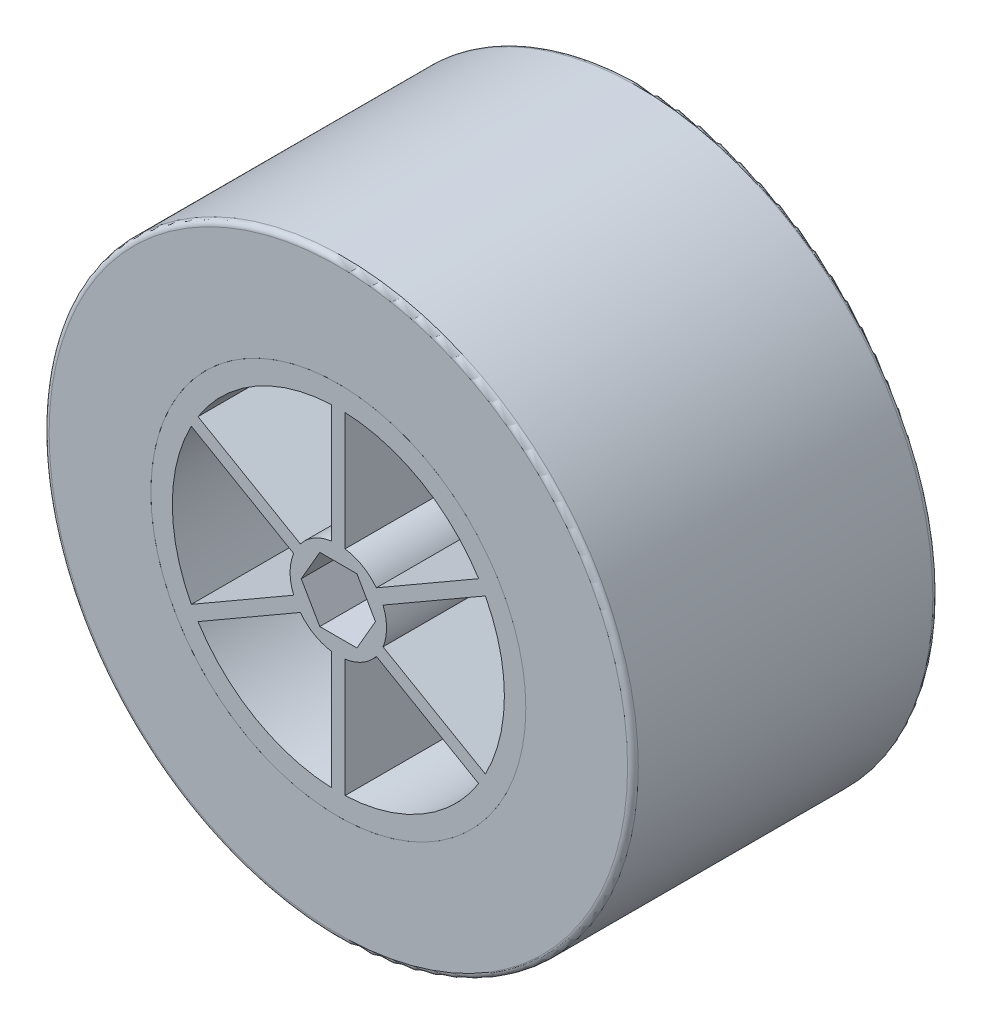
from build123d import *

# Parameters (mm, degrees)
EXTRUDE_1_DEPTH      = 28.5
EXTRUDE_1_DEPTH_BACK = 28.5
SKETCH_1_R           = 55
SKETCH_1_R_2         = 35
FILLET_1_R           = 1
SKETCH_2_R           = 35
SKETCH_2_R_2         = 31
EXTRUDE_2_DEPTH      = 57
EXTRUDE_3_DEPTH      = 57
EXTRUDE_4_DEPTH      = 2
EXTRUDE_4_DEPTH_BACK = 10
EXTRUDE_5_DEPTH      = 10
FILLET_2_R           = 2
FILLET_3_R           = 2


with BuildPart() as part:
    # ｽｹｯﾁ1 → ﾎﾞｽ - 押し出し1 (new, two sides: drawn at the far end of the back side and taken through both)
    with BuildSketch(Plane.XY.offset(-EXTRUDE_1_DEPTH_BACK)):
        Circle(SKETCH_1_R)
        Circle(SKETCH_1_R_2, mode=Mode.SUBTRACT)
    extrude(amount=EXTRUDE_1_DEPTH + EXTRUDE_1_DEPTH_BACK)

    # ﾌｨﾚｯﾄ1
    fillet_1_edges = [part.edges().sort_by_distance(p)[0] for p in [
        (-55, 0, -28.5),
        (-55, 0, 28.5),
    ]]
    fillet(fillet_1_edges, radius=FILLET_1_R)


with BuildPart() as body_2:
    # ｽｹｯﾁ2 → ﾎﾞｽ - 押し出し2 (new body)
    with BuildSketch(Plane(origin=(0, 0, -28.5), x_dir=(-1, 0, 0), z_dir=(0, 0, -1))):
        Circle(SKETCH_2_R)
        Circle(SKETCH_2_R_2, mode=Mode.SUBTRACT)
    extrude(amount=-EXTRUDE_2_DEPTH)

    # ｽｹｯﾁ3 → ﾎﾞｽ - 押し出し3 (add)
    with BuildSketch(Plane(origin=(0, 0, -28.5), x_dir=(-1, 0, 0), z_dir=(0, 0, -1))):
        with BuildLine():
            ThreePointArc((1.25, 30.974788135), (0, 31), (-1.25, 30.974788135))
            Line((-1.25, 30.974788135), (-1.25, 8.912771735))
            ThreePointArc((-1.25, 8.912771735), (-4.5, 7.794228634), (-7.093686741, 5.538917622))
            Line((-7.093686741, 5.538917622), (-26.199953402, 16.569925822))
            ThreePointArc((-26.199953402, 16.569925822), (-26.846787517, 15.5), (-27.449953402, 14.404862313))
            Line((-27.449953402, 14.404862313), (-8.343686741, 3.373854113))
            ThreePointArc((-8.343686741, 3.373854113), (-9, 0), (-8.343686741, -3.373854113))
            Line((-8.343686741, -3.373854113), (-27.449953402, -14.404862313))
            ThreePointArc((-27.449953402, -14.404862313), (-26.846787517, -15.5), (-26.199953402, -16.569925822))
            Line((-26.199953402, -16.569925822), (-7.093686741, -5.538917622))
            ThreePointArc((-7.093686741, -5.538917622), (-4.5, -7.794228634), (-1.25, -8.912771735))
            Line((-1.25, -8.912771735), (-1.25, -30.974788135))
            ThreePointArc((-1.25, -30.974788135), (0, -31), (1.25, -30.974788135))
            Line((1.25, -30.974788135), (1.25, -8.912771735))
            ThreePointArc((1.25, -8.912771735), (4.5, -7.794228634), (7.093686741, -5.538917622))
            Line((7.093686741, -5.538917622), (26.199953402, -16.569925822))
            ThreePointArc((26.199953402, -16.569925822), (26.846787517, -15.5), (27.449953402, -14.404862313))
            Line((27.449953402, -14.404862313), (8.343686741, -3.373854113))
            ThreePointArc((8.343686741, -3.373854113), (9, 0), (8.343686741, 3.373854113))
            Line((8.343686741, 3.373854113), (27.449953402, 14.404862313))
            ThreePointArc((27.449953402, 14.404862313), (26.846787517, 15.5), (26.199953402, 16.569925822))
            Line((26.199953402, 16.569925822), (7.093686741, 5.538917622))
            ThreePointArc((7.093686741, 5.538917622), (4.5, 7.794228634), (1.25, 8.912771735))
            Line((1.25, 8.912771735), (1.25, 30.974788135))
        make_face()
        Polygon((-3.464101615, 6), (3.464101615, 6), (6.92820323, 0), (3.464101615, -6), (-3.464101615, -6), (-6.92820323, 0), align=None, mode=Mode.SUBTRACT)
    extrude(amount=-EXTRUDE_3_DEPTH)


with BuildPart() as body_3:
    # ｽｹｯﾁ4 → ﾎﾞｽ - 押し出し4 (new, two sides: drawn at the far end of the back side and taken through both)
    with BuildSketch(Plane(origin=(0, 0, -28.5), x_dir=(-1, 0, 0), z_dir=(0, 0, -1)).offset(-EXTRUDE_4_DEPTH_BACK)):
        Polygon((-3.464101615, 6), (-6.92820323, 0), (-3.464101615, -6), (3.464101615, -6), (6.92820323, 0), (3.464101615, 6), align=None)
        with BuildLine():
            Line((-1.322875656, 1.5), (1.322875656, 1.5))
            ThreePointArc((1.322875656, 1.5), (0, -2), (-1.322875656, 1.5))
        make_face(mode=Mode.SUBTRACT)
    extrude(amount=EXTRUDE_4_DEPTH + EXTRUDE_4_DEPTH_BACK)

    # ｽｹｯﾁ7 → ﾎﾞｽ - 押し出し5 (add)
    with BuildSketch(Plane(origin=(0, 0, -30.5), x_dir=(-1, 0, 0), z_dir=(0, 0, -1))):
        with BuildLine():
            Line((-8, 6), (8, 6))
            ThreePointArc((8, 6), (0, -10), (-8, 6))
        make_face()
        with BuildLine():
            Line((1.322875656, 1.5), (-1.322875656, 1.5))
            ThreePointArc((-1.322875656, 1.5), (0, -2), (1.322875656, 1.5))
        make_face(mode=Mode.SUBTRACT)
    extrude(amount=EXTRUDE_5_DEPTH)

    # ﾌｨﾚｯﾄ2
    fillet_2_edges = [body_3.edges().sort_by_distance(p)[0] for p in [
        (5.196152423, -3, -30.5),
        (0, -6, -30.5),
        (-5.196152423, -3, -30.5),
        (-5.196152423, 3, -30.5),
        (5.196152423, 3, -30.5),
    ]]
    fillet(fillet_2_edges, radius=FILLET_2_R)

    # ﾌｨﾚｯﾄ3
    fillet_3_edges = [body_3.edges().sort_by_distance(p)[0] for p in [
        (8, 6, -35.5),
        (-8, 6, -35.5),
    ]]
    fillet(fillet_3_edges, radius=FILLET_3_R)


solid = Compound([part.part, body_2.part, body_3.part])
